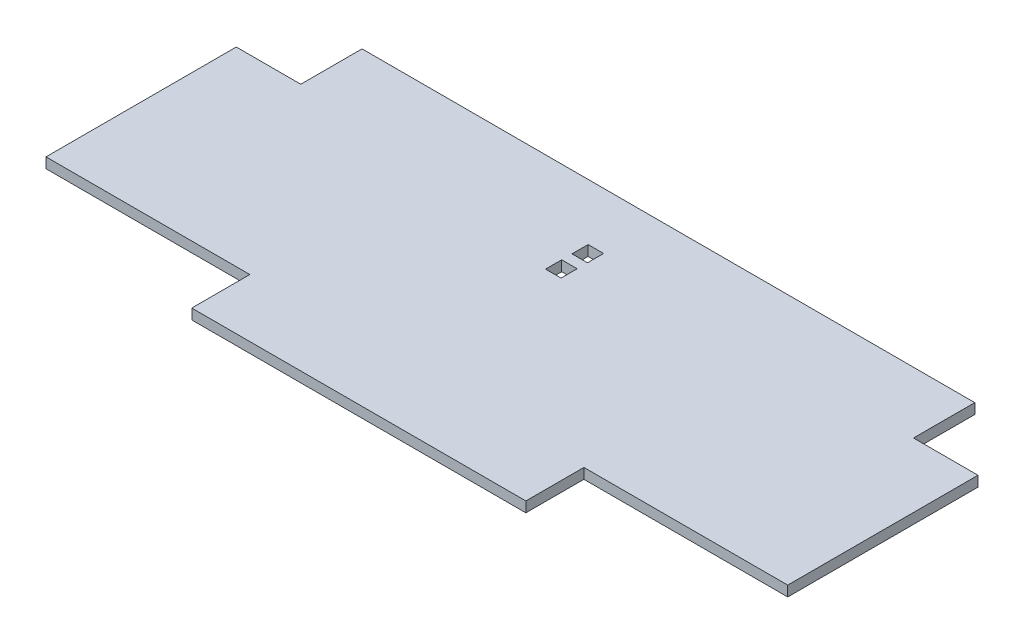
from build123d import *

# Parameters (mm, degrees)
EXTRUDE_1_DEPTH     = 1.6
SKETCH_2_W          = 2.4
SKETCH_2_H          = 2.5
CUT_EXTRUDE_1_DEPTH = 10


with BuildPart() as part:
    # 草图1 → 凸台-拉伸1 (new body)
    with BuildSketch(Plane(origin=(0, 0, 0), x_dir=(1, 0, 0), z_dir=(0, 1, 0))):
        Polygon((-115, 9), (-83.4, 9), (-83.4, 0), (-31.6, 0), (-31.6, 9), (0, 9), (0, 38.5), (-10, 38.5), (-10, 48), (-105, 48), (-105, 38.5), (-115, 38.5), align=None)
    extrude(amount=EXTRUDE_1_DEPTH)

    # 草图2 → 切除-拉伸1 (cut)
    with BuildSketch(Plane(origin=(0, 1.6, 0), x_dir=(1, 0, 0), z_dir=(0, 1, 0))):
        with Locations((-60, 38)):
            Rectangle(SKETCH_2_W, SKETCH_2_H)
        with Locations((-60, 33.9)):
            Rectangle(SKETCH_2_W, SKETCH_2_H)
    extrude(amount=-CUT_EXTRUDE_1_DEPTH, mode=Mode.SUBTRACT)


solid = part.part
